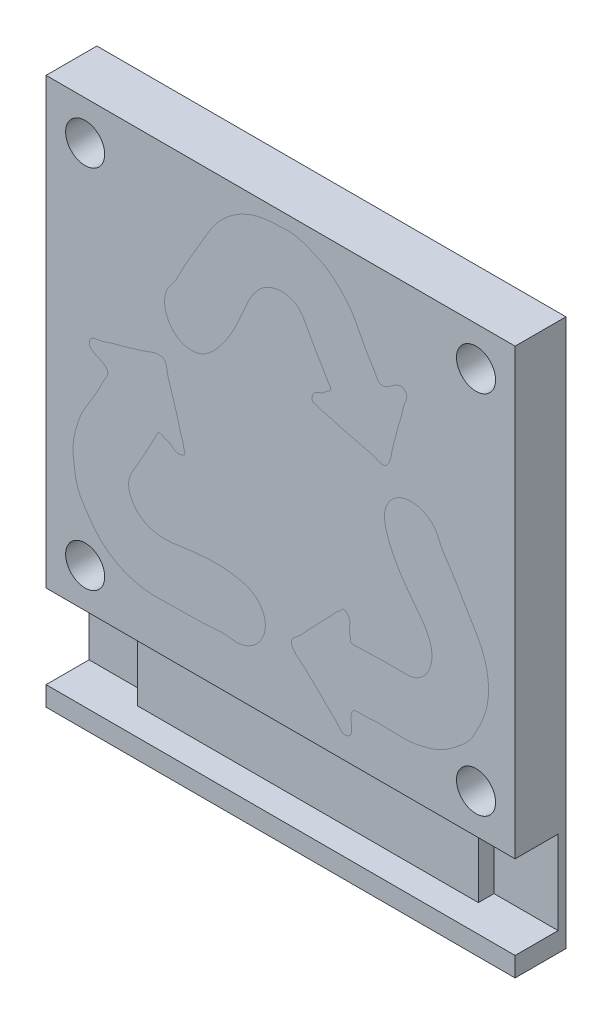
from build123d import *

# Parameters (mm, degrees)
SKETCH1_W               = 43.6
SKETCH1_H               = 10.7
SKETCH1_W_2             = 4
SKETCH1_W_3             = 4.2
BACK_PLATE_DEPTH        = 1
SKETCH1_4_W             = 43.6
SKETCH1_4_H             = 10.7
NEOPIXEL_BACK_DEPTH     = 3
MAIN_COLOR_DEPTH        = 6.5
HIGHLIGHT_COLOR_DEPTH   = 6.5
HIGHLIGHT_COLOR_2_DEPTH = 6.5
HIGHLIGHT_COLOR_3_DEPTH = 6.5
SKETCH2_R               = 2.5
MOUNTING_HOLES_DEPTH    = 6.5


with BuildPart() as part:
    # Sketch1 → Back Plate (new body)
    # profile 1 of 7: a face of its own
    with BuildSketch(Plane.XY):
        Polygon((20.794990646, 61.879816243), (-39.205009354, 61.879816243), (-39.205009354, 5.079816243), (-35.005009354, 5.079816243), (-31.005009354, 5.079816243), (12.594990646, 5.079816243), (16.594990646, 5.079816243), (20.794990646, 5.079816243), align=None)
        with BuildLine():
            add(Edge.make_bspline(
                [(-14.932833275, 11.260488615), (-14.211122462, 11.246479014), (-12.301173882, 11.821993234), (-10.637858763, 14.596238455), (-11.970326198, 17.729398447), (-16.004561997, 18.934226507), (-20.601791865, 18.598259261), (-25.501234693, 17.672418957), (-28.321203915, 19.876715866), (-28.911939468, 22.363144717), (-27.649353728, 24.299528952), (-26.418672732, 26.545418424), (-25.56709335, 28.10743789), (-24.755037692, 29.744407194), (-24.167286622, 29.245811636), (-23.570242745, 29.193122767), (-23.029827832, 28.757283001), (-22.381701098, 28.278940419), (-21.265335772, 28.637969787), (-21.616976307, 29.292005412), (-21.615510794, 29.892707756), (-21.977364206, 30.701263913), (-22.184042024, 31.758755071), (-22.557325125, 32.89736122), (-22.894486666, 34.112450017), (-23.335595407, 35.391173538), (-23.738474432, 36.627907385), (-23.825549347, 38.046762252), (-25.150985539, 38.234935485), (-26.35286337, 37.645479828), (-27.807657491, 37.275002057), (-29.314329264, 36.756968029), (-30.773401502, 36.485589499), (-32.12567634, 35.880098974), (-33.580464043, 35.881934014), (-33.764894748, 34.714018902), (-33.099289202, 34.193446147), (-32.396608444, 33.897285696), (-31.669904174, 33.591867162), (-31.102309041, 32.832199677), (-31.799519447, 31.890184245), (-32.327303727, 30.676423162), (-33.10359235, 29.332670031), (-33.913573117, 28.007198566), (-34.706364455, 26.745654687), (-35.235400578, 25.235626723), (-35.683008447, 23.637477571), (-35.811767141, 22.000318336), (-35.620910841, 20.561821299), (-35.434918361, 19.094985505), (-34.982751412, 17.569886476), (-34.018867914, 16.164935257), (-33.012629221, 14.663640229), (-31.649306519, 13.271116317), (-29.967588463, 12.208683476), (-28.125413742, 11.510563165), (-26.267726204, 11.122461398), (-24.220136947, 11.149666501), (-22.24944595, 11.191983133), (-20.121409937, 11.216760548), (-18.177570947, 11.257549028), (-16.376484579, 11.491066584), (-15.377736171, 11.269124916), (-14.932833275, 11.260488615)],
                knots=[0, 0, 0, 0, 0.021390715, 0.055730115, 0.081326468, 0.110478541, 0.172031065, 0.221618951, 0.247569004, 0.270370411, 0.289520948, 0.313837176, 0.344637393, 0.350629222, 0.357163846, 0.361727942, 0.36870799, 0.376673268, 0.386302475, 0.390190194, 0.395737899, 0.404311636, 0.415753711, 0.427728092, 0.439702474, 0.453254936, 0.467208049, 0.480475812, 0.487516412, 0.502252165, 0.52003998, 0.531767081, 0.54957229, 0.563171875, 0.577276505, 0.58479617, 0.591054685, 0.600466059, 0.607748714, 0.614456071, 0.624898574, 0.637302985, 0.65544663, 0.670098677, 0.683551579, 0.699384013, 0.717269115, 0.732641975, 0.74761716, 0.760142825, 0.776501272, 0.794085379, 0.810269094, 0.830075374, 0.851297274, 0.868642175, 0.888248238, 0.907092241, 0.929112511, 0.94671146, 0.970107663, 0.986813567, 1, 1, 1, 1], degree=3))
        make_face(mode=Mode.SUBTRACT)
        with BuildLine():
            add(Edge.make_bspline(
                [(10.815034806, 36.11915622), (10.469153887, 36.752740592), (9.021920139, 38.125560564), (5.787967941, 38.193434841), (3.728608776, 35.482125041), (4.683910063, 31.381628903), (7.256330106, 27.55670386), (10.490844157, 23.762018216), (9.975939851, 20.219981396), (8.110135315, 18.473536332), (5.802470207, 18.609140187), (3.241901568, 18.563495017), (1.463185832, 18.527962174), (-0.360998059, 18.42092933), (-0.219673162, 19.178607444), (-0.470122349, 19.723137253), (-0.359802185, 20.408581664), (-0.266014897, 21.208634059), (-1.1315818, 21.999815179), (-1.525005218, 21.370028169), (-2.047299331, 21.073288698), (-2.5698204, 20.357975701), (-3.3854658, 19.653897687), (-4.188886425, 18.764921008), (-5.076634147, 17.869363823), (-5.968064677, 16.85198367), (-6.84200315, 15.888628252), (-8.03074265, 15.10912227), (-7.536569742, 13.864942458), (-6.428509182, 13.113829893), (-5.385105576, 12.034483504), (-4.187847662, 10.983297233), (-3.22836577, 9.851072608), (-2.031769914, 8.977331017), (-1.311634584, 7.713283653), (-0.206081044, 8.132558934), (-0.084298238, 8.968738151), (-0.175757353, 9.725776123), (-0.27109623, 10.508265787), (0.106906996, 11.377962564), (1.270713398, 11.239940535), (2.58641296, 11.38383938), (4.138264133, 11.376461138), (5.690956899, 11.330759646), (7.179615989, 11.268268235), (8.753173894, 11.558059872), (10.362847053, 11.962270007), (11.848208263, 12.662677916), (13.002515766, 13.542037934), (14.183841707, 14.431233903), (15.283704705, 15.580443797), (16.025382367, 17.114351738), (16.829699046, 18.732831812), (17.36242244, 20.607392406), (17.450582493, 22.594643514), (17.142820311, 24.540475498), (16.558184784, 26.345974673), (15.518742709, 28.11032216), (14.504329538, 29.800404887), (13.427085229, 31.635805631), (12.427320332, 33.303331903), (11.331036493, 34.751297475), (11.028255142, 35.72857939), (10.815034806, 36.11915622)],
                knots=[0, 0, 0, 0, 0.021390715, 0.055730115, 0.081326468, 0.110478541, 0.172031065, 0.221618951, 0.247569004, 0.270370411, 0.289520948, 0.313837176, 0.344637393, 0.350629222, 0.357163846, 0.361727942, 0.36870799, 0.376673268, 0.386302475, 0.390190194, 0.395737899, 0.404311636, 0.415753711, 0.427728092, 0.439702474, 0.453254936, 0.467208049, 0.480475812, 0.487516412, 0.502252165, 0.52003998, 0.531767081, 0.54957229, 0.563171875, 0.577276505, 0.58479617, 0.591054685, 0.600466059, 0.607748714, 0.614456071, 0.624898574, 0.637302985, 0.65544663, 0.670098677, 0.683551579, 0.699384013, 0.717269115, 0.732641975, 0.74761716, 0.760142825, 0.776501272, 0.794085379, 0.810269094, 0.830075374, 0.851297274, 0.868642175, 0.888248238, 0.907092241, 0.929112511, 0.94671146, 0.970107663, 0.986813567, 1, 1, 1, 1], degree=3))
        make_face(mode=Mode.SUBTRACT)
        with BuildLine():
            add(Edge.make_bspline(
                [(-23.493635244, 46.330616341), (-23.880043839, 45.720902339), (-24.378946787, 43.789525616), (-22.870223368, 40.928265863), (-19.500421041, 40.44185731), (-16.377418911, 43.265600717), (-14.279537262, 47.370023823), (-12.529139774, 52.038838333), (-9.181678714, 53.305983048), (-6.749578576, 52.521007988), (-5.749229908, 50.437019218), (-4.46773619, 48.219730538), (-3.574192825, 46.681331204), (-2.596070332, 45.137835405), (-3.327246067, 44.894050879), (-3.682042474, 44.410980473), (-4.33501045, 44.175104654), (-5.080195743, 43.869198183), (-5.352448918, 42.72856159), (-4.610886128, 42.689853801), (-4.098112868, 42.376949602), (-3.219153678, 42.266805638), (-2.207889693, 41.894853462), (-1.040844672, 41.623246842), (0.172844208, 41.281080228), (1.494862702, 40.994762456), (2.761150682, 40.697547267), (4.019289008, 40.035868244), (4.86780784, 41.071342076), (4.987437089, 42.404630167), (5.425483942, 43.840525242), (5.764301362, 45.39732383), (6.289286564, 46.785462382), (6.473235499, 48.255642236), (7.229565, 49.498371618), (6.326812478, 50.26196724), (5.536456882, 49.963027835), (4.918713755, 49.515965546), (4.280592322, 49.053169032), (3.336686307, 48.962062733), (2.893088906, 50.0468285), (2.129279005, 51.127738602), (1.383267323, 52.488533617), (0.670364302, 53.868646921), (0.003194172, 55.200898804), (-1.013241437, 56.43658579), (-2.147256768, 57.648378983), (-3.480044028, 58.607830537), (-4.808817208, 59.190978621), (-6.159293462, 59.792987207), (-7.697672694, 60.197673916), (-9.39882342, 60.102565903), (-11.204311737, 60.021233203), (-13.102072195, 59.578201738), (-14.882828765, 58.691722635), (-16.435385487, 57.479061391), (-17.73095912, 56.092297196), (-18.770014862, 54.327722162), (-19.756256219, 52.621046537), (-20.839124073, 50.788958001), (-21.812740697, 49.106030674), (-22.547533715, 47.445150855), (-23.255431383, 46.706478141), (-23.493635244, 46.330616341)],
                knots=[0, 0, 0, 0, 0.021390715, 0.055730115, 0.081326468, 0.110478541, 0.172031065, 0.221618951, 0.247569004, 0.270370411, 0.289520948, 0.313837176, 0.344637393, 0.350629222, 0.357163846, 0.361727942, 0.36870799, 0.376673268, 0.386302475, 0.390190194, 0.395737899, 0.404311636, 0.415753711, 0.427728092, 0.439702474, 0.453254936, 0.467208049, 0.480475812, 0.487516412, 0.502252165, 0.52003998, 0.531767081, 0.54957229, 0.563171875, 0.577276505, 0.58479617, 0.591054685, 0.600466059, 0.607748714, 0.614456071, 0.624898574, 0.637302985, 0.65544663, 0.670098677, 0.683551579, 0.699384013, 0.717269115, 0.732641975, 0.74761716, 0.760142825, 0.776501272, 0.794085379, 0.810269094, 0.830075374, 0.851297274, 0.868642175, 0.888248238, 0.907092241, 0.929112511, 0.94671146, 0.970107663, 0.986813567, 1, 1, 1, 1], degree=3))
        make_face(mode=Mode.SUBTRACT)
    # profile 2 of 7: a face of its own
    with BuildSketch(Plane.XY):
        with Locations((-9.205009354, -0.270183757)):
            Rectangle(SKETCH1_W, SKETCH1_H)
    # profile 3 of 7: a face of its own
    with BuildSketch(Plane.XY):
        with Locations((-33.005009354, -0.270183757)):
            Rectangle(SKETCH1_W_2, SKETCH1_H)
    # profile 4 of 7: a face of its own
    with BuildSketch(Plane.XY):
        with Locations((-37.105009354, -0.270183757)):
            Rectangle(SKETCH1_W_3, SKETCH1_H)
    # profile 5 of 7: a face of its own
    with BuildSketch(Plane.XY):
        Polygon((-35.005009354, -5.620183757), (-39.205009354, -5.620183757), (-39.205009354, -8.120183757), (20.794990646, -8.120183757), (20.794990646, -5.620183757), (16.594990646, -5.620183757), (12.594990646, -5.620183757), (-31.005009354, -5.620183757), align=None)
    # profile 6 of 7: a face of its own
    with BuildSketch(Plane.XY):
        with Locations((14.594990646, -0.270183757)):
            Rectangle(SKETCH1_W_2, SKETCH1_H)
    # profile 7 of 7: a face of its own
    with BuildSketch(Plane.XY):
        with Locations((18.694990646, -0.270183757)):
            Rectangle(SKETCH1_W_3, SKETCH1_H)
    extrude(amount=BACK_PLATE_DEPTH)

    # Sketch1<4> → Neopixel Back (add)
    with BuildSketch(Plane.XY):
        with Locations((-9.205009354, -0.270183757)):
            Rectangle(SKETCH1_4_W, SKETCH1_4_H)
    extrude(amount=NEOPIXEL_BACK_DEPTH)

    # Sketch1<5> → Main Color (add)
    # profile 1 of 2: a face of its own
    with BuildSketch(Plane.XY):
        Polygon((20.794990646, 61.879816243), (-39.205009354, 61.879816243), (-39.205009354, 5.079816243), (-35.005009354, 5.079816243), (-31.005009354, 5.079816243), (12.594990646, 5.079816243), (16.594990646, 5.079816243), (20.794990646, 5.079816243), align=None)
        with BuildLine():
            add(Edge.make_bspline(
                [(-14.932833275, 11.260488615), (-14.211122462, 11.246479014), (-12.301173882, 11.821993234), (-10.637858763, 14.596238455), (-11.970326198, 17.729398447), (-16.004561997, 18.934226507), (-20.601791865, 18.598259261), (-25.501234693, 17.672418957), (-28.321203915, 19.876715866), (-28.911939468, 22.363144717), (-27.649353728, 24.299528952), (-26.418672732, 26.545418424), (-25.56709335, 28.10743789), (-24.755037692, 29.744407194), (-24.167286622, 29.245811636), (-23.570242745, 29.193122767), (-23.029827832, 28.757283001), (-22.381701098, 28.278940419), (-21.265335772, 28.637969787), (-21.616976307, 29.292005412), (-21.615510794, 29.892707756), (-21.977364206, 30.701263913), (-22.184042024, 31.758755071), (-22.557325125, 32.89736122), (-22.894486666, 34.112450017), (-23.335595407, 35.391173538), (-23.738474432, 36.627907385), (-23.825549347, 38.046762252), (-25.150985539, 38.234935485), (-26.35286337, 37.645479828), (-27.807657491, 37.275002057), (-29.314329264, 36.756968029), (-30.773401502, 36.485589499), (-32.12567634, 35.880098974), (-33.580464043, 35.881934014), (-33.764894748, 34.714018902), (-33.099289202, 34.193446147), (-32.396608444, 33.897285696), (-31.669904174, 33.591867162), (-31.102309041, 32.832199677), (-31.799519447, 31.890184245), (-32.327303727, 30.676423162), (-33.10359235, 29.332670031), (-33.913573117, 28.007198566), (-34.706364455, 26.745654687), (-35.235400578, 25.235626723), (-35.683008447, 23.637477571), (-35.811767141, 22.000318336), (-35.620910841, 20.561821299), (-35.434918361, 19.094985505), (-34.982751412, 17.569886476), (-34.018867914, 16.164935257), (-33.012629221, 14.663640229), (-31.649306519, 13.271116317), (-29.967588463, 12.208683476), (-28.125413742, 11.510563165), (-26.267726204, 11.122461398), (-24.220136947, 11.149666501), (-22.24944595, 11.191983133), (-20.121409937, 11.216760548), (-18.177570947, 11.257549028), (-16.376484579, 11.491066584), (-15.377736171, 11.269124916), (-14.932833275, 11.260488615)],
                knots=[0, 0, 0, 0, 0.021390715, 0.055730115, 0.081326468, 0.110478541, 0.172031065, 0.221618951, 0.247569004, 0.270370411, 0.289520948, 0.313837176, 0.344637393, 0.350629222, 0.357163846, 0.361727942, 0.36870799, 0.376673268, 0.386302475, 0.390190194, 0.395737899, 0.404311636, 0.415753711, 0.427728092, 0.439702474, 0.453254936, 0.467208049, 0.480475812, 0.487516412, 0.502252165, 0.52003998, 0.531767081, 0.54957229, 0.563171875, 0.577276505, 0.58479617, 0.591054685, 0.600466059, 0.607748714, 0.614456071, 0.624898574, 0.637302985, 0.65544663, 0.670098677, 0.683551579, 0.699384013, 0.717269115, 0.732641975, 0.74761716, 0.760142825, 0.776501272, 0.794085379, 0.810269094, 0.830075374, 0.851297274, 0.868642175, 0.888248238, 0.907092241, 0.929112511, 0.94671146, 0.970107663, 0.986813567, 1, 1, 1, 1], degree=3))
        make_face(mode=Mode.SUBTRACT)
        with BuildLine():
            add(Edge.make_bspline(
                [(10.815034806, 36.11915622), (10.469153887, 36.752740592), (9.021920139, 38.125560564), (5.787967941, 38.193434841), (3.728608776, 35.482125041), (4.683910063, 31.381628903), (7.256330106, 27.55670386), (10.490844157, 23.762018216), (9.975939851, 20.219981396), (8.110135315, 18.473536332), (5.802470207, 18.609140187), (3.241901568, 18.563495017), (1.463185832, 18.527962174), (-0.360998059, 18.42092933), (-0.219673162, 19.178607444), (-0.470122349, 19.723137253), (-0.359802185, 20.408581664), (-0.266014897, 21.208634059), (-1.1315818, 21.999815179), (-1.525005218, 21.370028169), (-2.047299331, 21.073288698), (-2.5698204, 20.357975701), (-3.3854658, 19.653897687), (-4.188886425, 18.764921008), (-5.076634147, 17.869363823), (-5.968064677, 16.85198367), (-6.84200315, 15.888628252), (-8.03074265, 15.10912227), (-7.536569742, 13.864942458), (-6.428509182, 13.113829893), (-5.385105576, 12.034483504), (-4.187847662, 10.983297233), (-3.22836577, 9.851072608), (-2.031769914, 8.977331017), (-1.311634584, 7.713283653), (-0.206081044, 8.132558934), (-0.084298238, 8.968738151), (-0.175757353, 9.725776123), (-0.27109623, 10.508265787), (0.106906996, 11.377962564), (1.270713398, 11.239940535), (2.58641296, 11.38383938), (4.138264133, 11.376461138), (5.690956899, 11.330759646), (7.179615989, 11.268268235), (8.753173894, 11.558059872), (10.362847053, 11.962270007), (11.848208263, 12.662677916), (13.002515766, 13.542037934), (14.183841707, 14.431233903), (15.283704705, 15.580443797), (16.025382367, 17.114351738), (16.829699046, 18.732831812), (17.36242244, 20.607392406), (17.450582493, 22.594643514), (17.142820311, 24.540475498), (16.558184784, 26.345974673), (15.518742709, 28.11032216), (14.504329538, 29.800404887), (13.427085229, 31.635805631), (12.427320332, 33.303331903), (11.331036493, 34.751297475), (11.028255142, 35.72857939), (10.815034806, 36.11915622)],
                knots=[0, 0, 0, 0, 0.021390715, 0.055730115, 0.081326468, 0.110478541, 0.172031065, 0.221618951, 0.247569004, 0.270370411, 0.289520948, 0.313837176, 0.344637393, 0.350629222, 0.357163846, 0.361727942, 0.36870799, 0.376673268, 0.386302475, 0.390190194, 0.395737899, 0.404311636, 0.415753711, 0.427728092, 0.439702474, 0.453254936, 0.467208049, 0.480475812, 0.487516412, 0.502252165, 0.52003998, 0.531767081, 0.54957229, 0.563171875, 0.577276505, 0.58479617, 0.591054685, 0.600466059, 0.607748714, 0.614456071, 0.624898574, 0.637302985, 0.65544663, 0.670098677, 0.683551579, 0.699384013, 0.717269115, 0.732641975, 0.74761716, 0.760142825, 0.776501272, 0.794085379, 0.810269094, 0.830075374, 0.851297274, 0.868642175, 0.888248238, 0.907092241, 0.929112511, 0.94671146, 0.970107663, 0.986813567, 1, 1, 1, 1], degree=3))
        make_face(mode=Mode.SUBTRACT)
        with BuildLine():
            add(Edge.make_bspline(
                [(-23.493635244, 46.330616341), (-23.880043839, 45.720902339), (-24.378946787, 43.789525616), (-22.870223368, 40.928265863), (-19.500421041, 40.44185731), (-16.377418911, 43.265600717), (-14.279537262, 47.370023823), (-12.529139774, 52.038838333), (-9.181678714, 53.305983048), (-6.749578576, 52.521007988), (-5.749229908, 50.437019218), (-4.46773619, 48.219730538), (-3.574192825, 46.681331204), (-2.596070332, 45.137835405), (-3.327246067, 44.894050879), (-3.682042474, 44.410980473), (-4.33501045, 44.175104654), (-5.080195743, 43.869198183), (-5.352448918, 42.72856159), (-4.610886128, 42.689853801), (-4.098112868, 42.376949602), (-3.219153678, 42.266805638), (-2.207889693, 41.894853462), (-1.040844672, 41.623246842), (0.172844208, 41.281080228), (1.494862702, 40.994762456), (2.761150682, 40.697547267), (4.019289008, 40.035868244), (4.86780784, 41.071342076), (4.987437089, 42.404630167), (5.425483942, 43.840525242), (5.764301362, 45.39732383), (6.289286564, 46.785462382), (6.473235499, 48.255642236), (7.229565, 49.498371618), (6.326812478, 50.26196724), (5.536456882, 49.963027835), (4.918713755, 49.515965546), (4.280592322, 49.053169032), (3.336686307, 48.962062733), (2.893088906, 50.0468285), (2.129279005, 51.127738602), (1.383267323, 52.488533617), (0.670364302, 53.868646921), (0.003194172, 55.200898804), (-1.013241437, 56.43658579), (-2.147256768, 57.648378983), (-3.480044028, 58.607830537), (-4.808817208, 59.190978621), (-6.159293462, 59.792987207), (-7.697672694, 60.197673916), (-9.39882342, 60.102565903), (-11.204311737, 60.021233203), (-13.102072195, 59.578201738), (-14.882828765, 58.691722635), (-16.435385487, 57.479061391), (-17.73095912, 56.092297196), (-18.770014862, 54.327722162), (-19.756256219, 52.621046537), (-20.839124073, 50.788958001), (-21.812740697, 49.106030674), (-22.547533715, 47.445150855), (-23.255431383, 46.706478141), (-23.493635244, 46.330616341)],
                knots=[0, 0, 0, 0, 0.021390715, 0.055730115, 0.081326468, 0.110478541, 0.172031065, 0.221618951, 0.247569004, 0.270370411, 0.289520948, 0.313837176, 0.344637393, 0.350629222, 0.357163846, 0.361727942, 0.36870799, 0.376673268, 0.386302475, 0.390190194, 0.395737899, 0.404311636, 0.415753711, 0.427728092, 0.439702474, 0.453254936, 0.467208049, 0.480475812, 0.487516412, 0.502252165, 0.52003998, 0.531767081, 0.54957229, 0.563171875, 0.577276505, 0.58479617, 0.591054685, 0.600466059, 0.607748714, 0.614456071, 0.624898574, 0.637302985, 0.65544663, 0.670098677, 0.683551579, 0.699384013, 0.717269115, 0.732641975, 0.74761716, 0.760142825, 0.776501272, 0.794085379, 0.810269094, 0.830075374, 0.851297274, 0.868642175, 0.888248238, 0.907092241, 0.929112511, 0.94671146, 0.970107663, 0.986813567, 1, 1, 1, 1], degree=3))
        make_face(mode=Mode.SUBTRACT)
    # profile 2 of 2: a face of its own
    with BuildSketch(Plane.XY):
        Polygon((-35.005009354, -5.620183757), (-39.205009354, -5.620183757), (-39.205009354, -8.120183757), (20.794990646, -8.120183757), (20.794990646, -5.620183757), (16.594990646, -5.620183757), (12.594990646, -5.620183757), (-31.005009354, -5.620183757), align=None)
    extrude(amount=MAIN_COLOR_DEPTH)

    # Sketch2 → Mounting Holes (cut)
    with BuildSketch(Plane.XY.offset(6.5)):
        with Locations((-34.205009354, 56.879816243)):
            Circle(SKETCH2_R)
        with Locations((15.794990646, 56.879816243)):
            Circle(SKETCH2_R)
        with Locations((-34.205009354, 10.079816243)):
            Circle(SKETCH2_R)
        with Locations((15.794990646, 10.079816243)):
            Circle(SKETCH2_R)
    extrude(amount=-MOUNTING_HOLES_DEPTH, mode=Mode.SUBTRACT)


with BuildPart() as body_2:
    # Sketch1<6> → Highlight Color (new body)
    with BuildSketch(Plane.XY):
        with BuildLine():
            add(Edge.make_bspline(
                [(-14.932833275, 11.260488615), (-14.211122462, 11.246479014), (-12.301173882, 11.821993234), (-10.637858763, 14.596238455), (-11.970326198, 17.729398447), (-16.004561997, 18.934226507), (-20.601791865, 18.598259261), (-25.501234693, 17.672418957), (-28.321203915, 19.876715866), (-28.911939468, 22.363144717), (-27.649353728, 24.299528952), (-26.418672732, 26.545418424), (-25.56709335, 28.10743789), (-24.755037692, 29.744407194), (-24.167286622, 29.245811636), (-23.570242745, 29.193122767), (-23.029827832, 28.757283001), (-22.381701098, 28.278940419), (-21.265335772, 28.637969787), (-21.616976307, 29.292005412), (-21.615510794, 29.892707756), (-21.977364206, 30.701263913), (-22.184042024, 31.758755071), (-22.557325125, 32.89736122), (-22.894486666, 34.112450017), (-23.335595407, 35.391173538), (-23.738474432, 36.627907385), (-23.825549347, 38.046762252), (-25.150985539, 38.234935485), (-26.35286337, 37.645479828), (-27.807657491, 37.275002057), (-29.314329264, 36.756968029), (-30.773401502, 36.485589499), (-32.12567634, 35.880098974), (-33.580464043, 35.881934014), (-33.764894748, 34.714018902), (-33.099289202, 34.193446147), (-32.396608444, 33.897285696), (-31.669904174, 33.591867162), (-31.102309041, 32.832199677), (-31.799519447, 31.890184245), (-32.327303727, 30.676423162), (-33.10359235, 29.332670031), (-33.913573117, 28.007198566), (-34.706364455, 26.745654687), (-35.235400578, 25.235626723), (-35.683008447, 23.637477571), (-35.811767141, 22.000318336), (-35.620910841, 20.561821299), (-35.434918361, 19.094985505), (-34.982751412, 17.569886476), (-34.018867914, 16.164935257), (-33.012629221, 14.663640229), (-31.649306519, 13.271116317), (-29.967588463, 12.208683476), (-28.125413742, 11.510563165), (-26.267726204, 11.122461398), (-24.220136947, 11.149666501), (-22.24944595, 11.191983133), (-20.121409937, 11.216760548), (-18.177570947, 11.257549028), (-16.376484579, 11.491066584), (-15.377736171, 11.269124916), (-14.932833275, 11.260488615)],
                knots=[0, 0, 0, 0, 0.021390715, 0.055730115, 0.081326468, 0.110478541, 0.172031065, 0.221618951, 0.247569004, 0.270370411, 0.289520948, 0.313837176, 0.344637393, 0.350629222, 0.357163846, 0.361727942, 0.36870799, 0.376673268, 0.386302475, 0.390190194, 0.395737899, 0.404311636, 0.415753711, 0.427728092, 0.439702474, 0.453254936, 0.467208049, 0.480475812, 0.487516412, 0.502252165, 0.52003998, 0.531767081, 0.54957229, 0.563171875, 0.577276505, 0.58479617, 0.591054685, 0.600466059, 0.607748714, 0.614456071, 0.624898574, 0.637302985, 0.65544663, 0.670098677, 0.683551579, 0.699384013, 0.717269115, 0.732641975, 0.74761716, 0.760142825, 0.776501272, 0.794085379, 0.810269094, 0.830075374, 0.851297274, 0.868642175, 0.888248238, 0.907092241, 0.929112511, 0.94671146, 0.970107663, 0.986813567, 1, 1, 1, 1], degree=3))
        make_face()
    extrude(amount=HIGHLIGHT_COLOR_DEPTH)


with BuildPart() as body_3:
    # Sketch1<6> → Highlight Color 2 (new body)
    with BuildSketch(Plane.XY):
        with BuildLine():
            add(Edge.make_bspline(
                [(-23.493635244, 46.330616341), (-23.880043839, 45.720902339), (-24.378946787, 43.789525616), (-22.870223368, 40.928265863), (-19.500421041, 40.44185731), (-16.377418911, 43.265600717), (-14.279537262, 47.370023823), (-12.529139774, 52.038838333), (-9.181678714, 53.305983048), (-6.749578576, 52.521007988), (-5.749229908, 50.437019218), (-4.46773619, 48.219730538), (-3.574192825, 46.681331204), (-2.596070332, 45.137835405), (-3.327246067, 44.894050879), (-3.682042474, 44.410980473), (-4.33501045, 44.175104654), (-5.080195743, 43.869198183), (-5.352448918, 42.72856159), (-4.610886128, 42.689853801), (-4.098112868, 42.376949602), (-3.219153678, 42.266805638), (-2.207889693, 41.894853462), (-1.040844672, 41.623246842), (0.172844208, 41.281080228), (1.494862702, 40.994762456), (2.761150682, 40.697547267), (4.019289008, 40.035868244), (4.86780784, 41.071342076), (4.987437089, 42.404630167), (5.425483942, 43.840525242), (5.764301362, 45.39732383), (6.289286564, 46.785462382), (6.473235499, 48.255642236), (7.229565, 49.498371618), (6.326812478, 50.26196724), (5.536456882, 49.963027835), (4.918713755, 49.515965546), (4.280592322, 49.053169032), (3.336686307, 48.962062733), (2.893088906, 50.0468285), (2.129279005, 51.127738602), (1.383267323, 52.488533617), (0.670364302, 53.868646921), (0.003194172, 55.200898804), (-1.013241437, 56.43658579), (-2.147256768, 57.648378983), (-3.480044028, 58.607830537), (-4.808817208, 59.190978621), (-6.159293462, 59.792987207), (-7.697672694, 60.197673916), (-9.39882342, 60.102565903), (-11.204311737, 60.021233203), (-13.102072195, 59.578201738), (-14.882828765, 58.691722635), (-16.435385487, 57.479061391), (-17.73095912, 56.092297196), (-18.770014862, 54.327722162), (-19.756256219, 52.621046537), (-20.839124073, 50.788958001), (-21.812740697, 49.106030674), (-22.547533715, 47.445150855), (-23.255431383, 46.706478141), (-23.493635244, 46.330616341)],
                knots=[0, 0, 0, 0, 0.021390715, 0.055730115, 0.081326468, 0.110478541, 0.172031065, 0.221618951, 0.247569004, 0.270370411, 0.289520948, 0.313837176, 0.344637393, 0.350629222, 0.357163846, 0.361727942, 0.36870799, 0.376673268, 0.386302475, 0.390190194, 0.395737899, 0.404311636, 0.415753711, 0.427728092, 0.439702474, 0.453254936, 0.467208049, 0.480475812, 0.487516412, 0.502252165, 0.52003998, 0.531767081, 0.54957229, 0.563171875, 0.577276505, 0.58479617, 0.591054685, 0.600466059, 0.607748714, 0.614456071, 0.624898574, 0.637302985, 0.65544663, 0.670098677, 0.683551579, 0.699384013, 0.717269115, 0.732641975, 0.74761716, 0.760142825, 0.776501272, 0.794085379, 0.810269094, 0.830075374, 0.851297274, 0.868642175, 0.888248238, 0.907092241, 0.929112511, 0.94671146, 0.970107663, 0.986813567, 1, 1, 1, 1], degree=3))
        make_face()
    extrude(amount=HIGHLIGHT_COLOR_2_DEPTH)


with BuildPart() as body_4:
    # Sketch1<6> → Highlight Color 3 (new body)
    with BuildSketch(Plane.XY):
        with BuildLine():
            add(Edge.make_bspline(
                [(10.815034806, 36.11915622), (10.469153887, 36.752740592), (9.021920139, 38.125560564), (5.787967941, 38.193434841), (3.728608776, 35.482125041), (4.683910063, 31.381628903), (7.256330106, 27.55670386), (10.490844157, 23.762018216), (9.975939851, 20.219981396), (8.110135315, 18.473536332), (5.802470207, 18.609140187), (3.241901568, 18.563495017), (1.463185832, 18.527962174), (-0.360998059, 18.42092933), (-0.219673162, 19.178607444), (-0.470122349, 19.723137253), (-0.359802185, 20.408581664), (-0.266014897, 21.208634059), (-1.1315818, 21.999815179), (-1.525005218, 21.370028169), (-2.047299331, 21.073288698), (-2.5698204, 20.357975701), (-3.3854658, 19.653897687), (-4.188886425, 18.764921008), (-5.076634147, 17.869363823), (-5.968064677, 16.85198367), (-6.84200315, 15.888628252), (-8.03074265, 15.10912227), (-7.536569742, 13.864942458), (-6.428509182, 13.113829893), (-5.385105576, 12.034483504), (-4.187847662, 10.983297233), (-3.22836577, 9.851072608), (-2.031769914, 8.977331017), (-1.311634584, 7.713283653), (-0.206081044, 8.132558934), (-0.084298238, 8.968738151), (-0.175757353, 9.725776123), (-0.27109623, 10.508265787), (0.106906996, 11.377962564), (1.270713398, 11.239940535), (2.58641296, 11.38383938), (4.138264133, 11.376461138), (5.690956899, 11.330759646), (7.179615989, 11.268268235), (8.753173894, 11.558059872), (10.362847053, 11.962270007), (11.848208263, 12.662677916), (13.002515766, 13.542037934), (14.183841707, 14.431233903), (15.283704705, 15.580443797), (16.025382367, 17.114351738), (16.829699046, 18.732831812), (17.36242244, 20.607392406), (17.450582493, 22.594643514), (17.142820311, 24.540475498), (16.558184784, 26.345974673), (15.518742709, 28.11032216), (14.504329538, 29.800404887), (13.427085229, 31.635805631), (12.427320332, 33.303331903), (11.331036493, 34.751297475), (11.028255142, 35.72857939), (10.815034806, 36.11915622)],
                knots=[0, 0, 0, 0, 0.021390715, 0.055730115, 0.081326468, 0.110478541, 0.172031065, 0.221618951, 0.247569004, 0.270370411, 0.289520948, 0.313837176, 0.344637393, 0.350629222, 0.357163846, 0.361727942, 0.36870799, 0.376673268, 0.386302475, 0.390190194, 0.395737899, 0.404311636, 0.415753711, 0.427728092, 0.439702474, 0.453254936, 0.467208049, 0.480475812, 0.487516412, 0.502252165, 0.52003998, 0.531767081, 0.54957229, 0.563171875, 0.577276505, 0.58479617, 0.591054685, 0.600466059, 0.607748714, 0.614456071, 0.624898574, 0.637302985, 0.65544663, 0.670098677, 0.683551579, 0.699384013, 0.717269115, 0.732641975, 0.74761716, 0.760142825, 0.776501272, 0.794085379, 0.810269094, 0.830075374, 0.851297274, 0.868642175, 0.888248238, 0.907092241, 0.929112511, 0.94671146, 0.970107663, 0.986813567, 1, 1, 1, 1], degree=3))
        make_face()
    extrude(amount=HIGHLIGHT_COLOR_3_DEPTH)


solid = Compound([part.part, body_2.part, body_3.part, body_4.part])
